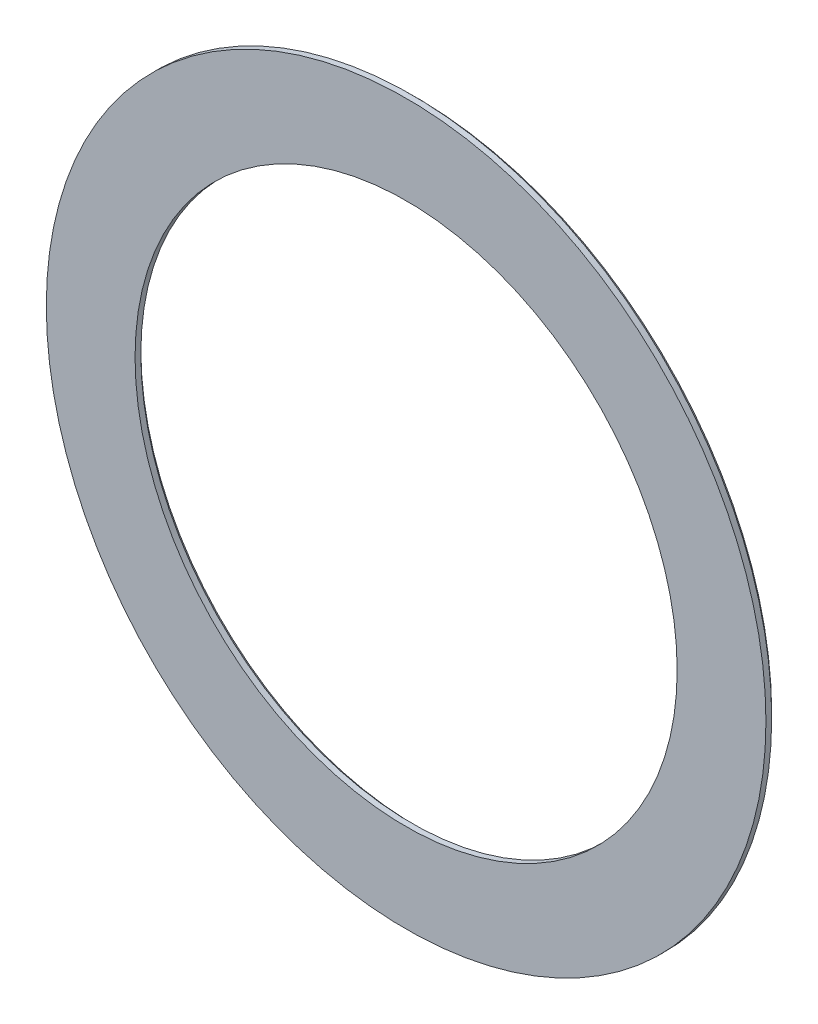
from build123d import *

# Parameters (mm, degrees)
SKETCH1_R           = 28.075
SKETCH1_R_2         = 21.15
BOSS_EXTRUDE1_DEPTH = 0.75
CHAMFER1_SIZE       = 0.3


with BuildPart() as part:
    # Sketch1 → Boss-Extrude1 (new body)
    with BuildSketch(Plane(origin=(0, 0, 0), x_dir=(0, 1, 0), z_dir=(0, 0, 1))):
        with Locations(Location((0, 0, 0), (0, 0, 270))):
            Circle(SKETCH1_R)
        with Locations(Location((0, 0, 0), (0, 0, 270))):
            Circle(SKETCH1_R_2, mode=Mode.SUBTRACT)
    extrude(amount=BOSS_EXTRUDE1_DEPTH)

    # Chamfer1
    chamfer1_edges = [part.edges().sort_by_distance(p)[0] for p in [
        (-28.075, 0, 0),
        (-21.15, 0, 0),
    ]]
    chamfer(chamfer1_edges, length=CHAMFER1_SIZE)


solid = part.part
